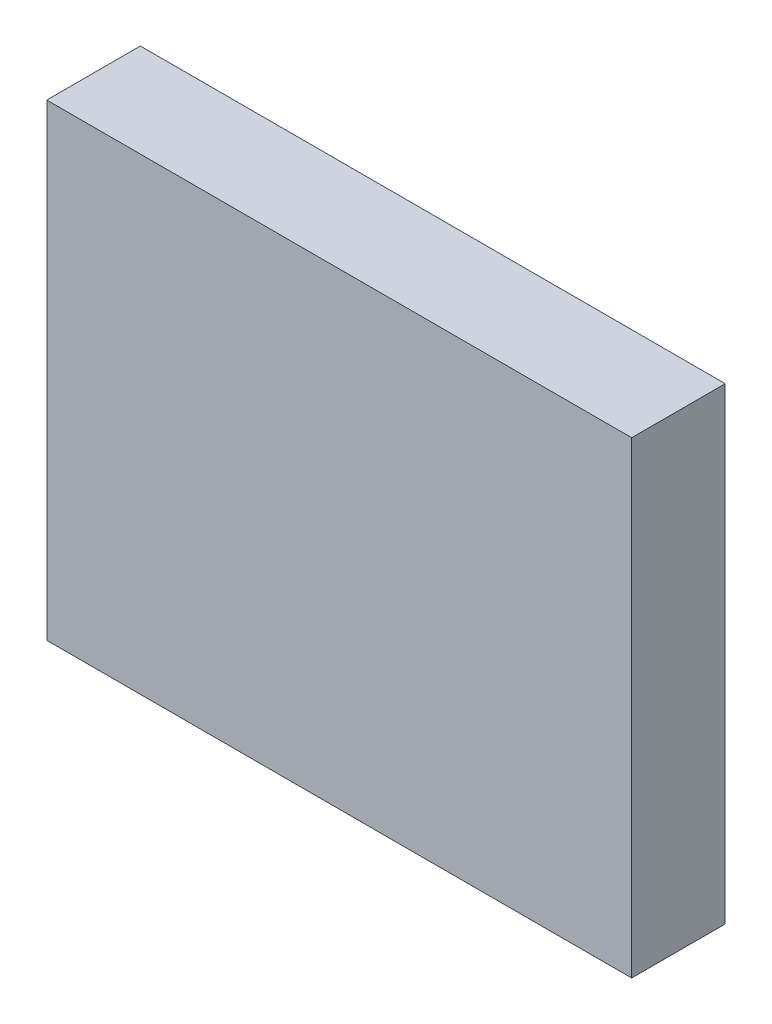
from build123d import *

# Parameters (mm, degrees)
SKETCH1_W           = 50
SKETCH1_H           = 40
BOSS_EXTRUDE1_DEPTH = 8


with BuildPart() as part:
    # Sketch1 → Boss-Extrude1 (new body)
    with BuildSketch(Plane.XY):
        Rectangle(SKETCH1_W, SKETCH1_H)
    extrude(amount=BOSS_EXTRUDE1_DEPTH)


solid = part.part
